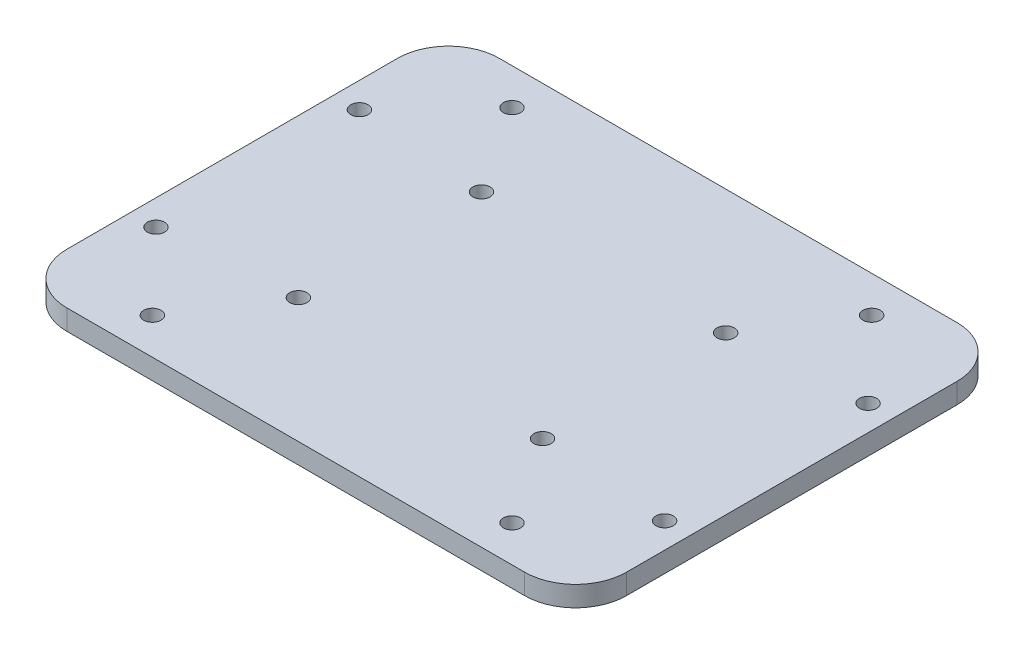
from build123d import *

# Parameters (mm, degrees)
SKETCH_1_W          = 110
SKETCH_1_H          = 85
SKETCH_1_R          = 1.7
EXTRUDE_1_DEPTH     = 4
SKETCH_2_R          = 1.7
CUT_EXTRUDE_1_DEPTH = 10
FILLET_1_R          = 10


with BuildPart() as part:
    # 草图1 → 凸台-拉伸1 (new body)
    with BuildSketch(Plane(origin=(0, 0, 0), x_dir=(1, 0, 0), z_dir=(0, 1, 0))):
        Rectangle(SKETCH_1_W, SKETCH_1_H)
        with Locations(Location((24, 18, 0), (0, 0, 270))):
            Circle(SKETCH_1_R, mode=Mode.SUBTRACT)
        with Locations(Location((-24, 18, 0), (0, 0, 270))):
            Circle(SKETCH_1_R, mode=Mode.SUBTRACT)
        with Locations(Location((-24, -18, 0), (0, 0, 270))):
            Circle(SKETCH_1_R, mode=Mode.SUBTRACT)
        with Locations(Location((24, -18, 0), (0, 0, 270))):
            Circle(SKETCH_1_R, mode=Mode.SUBTRACT)
        with Locations(Location((-35.355, 35.355, 0), (0, 0, 270))):
            Circle(SKETCH_1_R, mode=Mode.SUBTRACT)
        with Locations(Location((35.355, 35.355, 0), (0, 0, 270))):
            Circle(SKETCH_1_R, mode=Mode.SUBTRACT)
        with Locations(Location((35.355, -35.355, 0), (0, 0, 270))):
            Circle(SKETCH_1_R, mode=Mode.SUBTRACT)
        with Locations(Location((-35.355, -35.355, 0), (0, 0, 270))):
            Circle(SKETCH_1_R, mode=Mode.SUBTRACT)
    extrude(amount=EXTRUDE_1_DEPTH)

    # 草图2 → 切除-拉伸1 (cut)
    with BuildSketch(Plane(origin=(0, 4, 0), x_dir=(1, 0, 0), z_dir=(0, 1, 0))):
        with Locations(Location((50, 20, 0), (0, 0, 270))):
            Circle(SKETCH_2_R)
        with Locations(Location((50, -20, 0), (0, 0, 270))):
            Circle(SKETCH_2_R)
        with Locations(Location((-50, 20, 0), (0, 0, 270))):
            Circle(SKETCH_2_R)
        with Locations(Location((-50, -20, 0), (0, 0, 270))):
            Circle(SKETCH_2_R)
    extrude(amount=-CUT_EXTRUDE_1_DEPTH, mode=Mode.SUBTRACT)

    # 圆角1
    fillet_1_edges = [part.edges().sort_by_distance(p)[0] for p in [
        (55, 2, 42.5),
        (-55, 2, 42.5),
        (-55, 2, -42.5),
        (55, 2, -42.5),
    ]]
    fillet(fillet_1_edges, radius=FILLET_1_R)


solid = part.part
